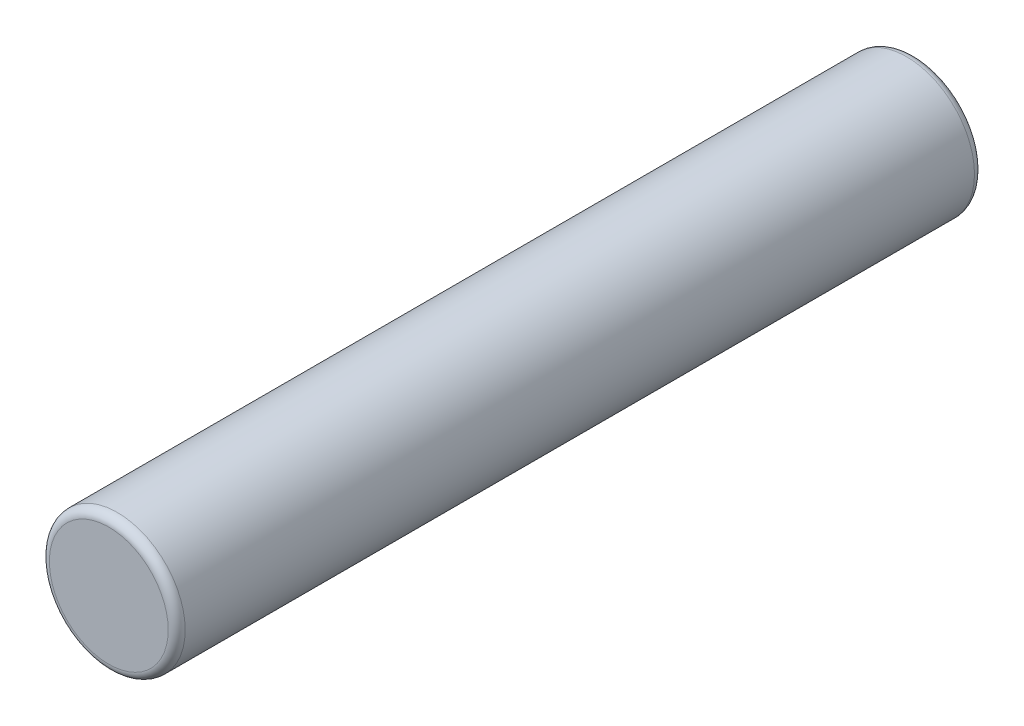
from build123d import *

# Parameters (mm, degrees)
SKETCH2_R           = 0.8
BOSS_EXTRUDE1_DEPTH = 9.5
FILLET1_R           = 0.1


with BuildPart() as part:
    # Sketch2 → Boss-Extrude1 (new body)
    with BuildSketch(Plane.XY):
        with Locations((-1.691182796, 0.341226968)):
            Circle(SKETCH2_R)
    extrude(amount=BOSS_EXTRUDE1_DEPTH)

    # Fillet1
    fillet1_edges = [part.edges().sort_by_distance(p)[0] for p in [
        (-2.491182796, 0.341226968, 0),
        (-2.491182796, 0.341226968, 9.5),
    ]]
    fillet(fillet1_edges, radius=FILLET1_R)


solid = part.part
